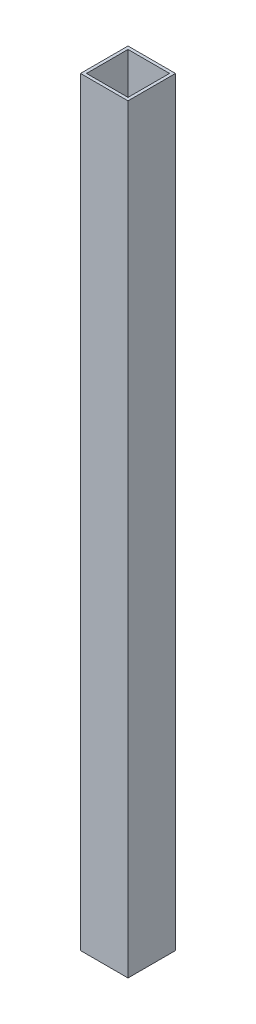
from build123d import *

# Parameters (mm, degrees)
SKETCH1_W           = 25.4
SKETCH1_H           = 25.4
SKETCH1_W_2         = 22.225
SKETCH1_H_2         = 22.225
BOSS_EXTRUDE1_DEPTH = 406.4


with BuildPart() as part:
    # Sketch1 → Boss-Extrude1 (new body)
    with BuildSketch(Plane(origin=(0, 0, 0), x_dir=(1, 0, 0), z_dir=(0, 1, 0))):
        Rectangle(SKETCH1_W, SKETCH1_H)
        Rectangle(SKETCH1_W_2, SKETCH1_H_2, mode=Mode.SUBTRACT)
    extrude(amount=BOSS_EXTRUDE1_DEPTH)


solid = part.part
